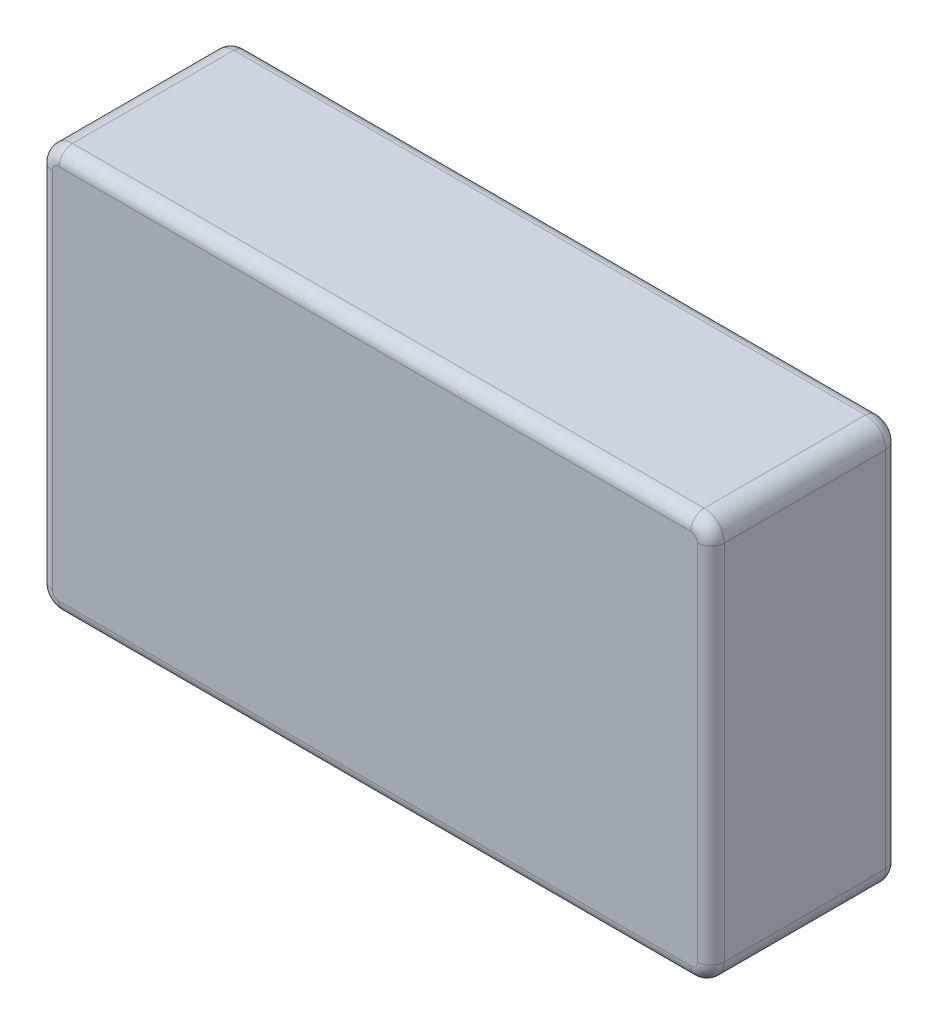
from build123d import *

# Parameters (mm, degrees)
BLOCK_START           = 323
BLOCK_1_DEPTH         = 28
BLOCK_EDGE_FILLET_1_R = 2


with BuildPart() as part:
    # Block sketch 1 → Block 1 (new body)
    with BuildSketch(Plane.XY.offset(BLOCK_START)):
        with BuildLine():
            Line((535, -110), (629, -110))
            ThreePointArc((629, -110), (631.121320344, -109.121320344), (632, -107))
            Line((632, -107), (632, -53))
            ThreePointArc((632, -53), (631.121320344, -50.878679656), (629, -50))
            Line((629, -50), (535, -50))
            ThreePointArc((535, -50), (532.878679656, -50.878679656), (532, -53))
            Line((532, -53), (532, -107))
            ThreePointArc((532, -107), (532.878679656, -109.121320344), (535, -110))
        make_face()
    extrude(amount=BLOCK_1_DEPTH)

    # Block edge fillet 1
    block_edge_fillet_1_edges = [part.edges().sort_by_distance(p)[0] for p in [
        (632, -80, 323),
        (631.121320344, -109.121320344, 323),
        (582, -110, 323),
        (532.878679656, -109.121320344, 323),
        (631.121320344, -109.121320344, 351),
        (632, -80, 351),
        (631.121320344, -50.878679656, 351),
        (582, -50, 351),
        (532.878679656, -50.878679656, 351),
        (532, -80, 351),
        (532.878679656, -109.121320344, 351),
        (532, -80, 323),
        (582, -110, 351),
        (532.878679656, -50.878679656, 323),
        (582, -50, 323),
        (631.121320344, -50.878679656, 323),
    ]]
    fillet(block_edge_fillet_1_edges, radius=BLOCK_EDGE_FILLET_1_R)


solid = part.part
